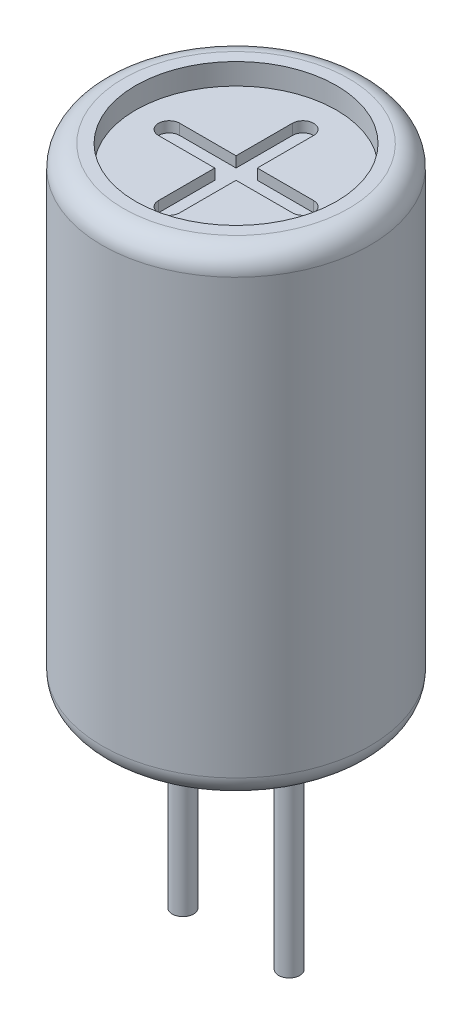
from build123d import *

# Parameters (mm, degrees)
SKETCH_2_R          = 3.15
EXTRUDE_1_DEPTH     = 11.2
FILLET_1_R          = 0.5
SKETCH_3_R          = 0.25
EXTRUDE_2_DEPTH     = 5
SKETCH_5_R          = 2.3625
CUT_EXTRUDE_1_DEPTH = 1
EXTRUDE_START       = 0.5
SKETCH_6_R          = 2.3625
EXTRUDE_3_DEPTH     = 0.5
CUT_EXTRUDE_2_DEPTH = 0.25
CUT_EXTRUDE_3_DEPTH = 0.25


with BuildPart() as part:
    # 草图2 → 凸台-拉伸1 (new body)
    with BuildSketch(Plane(origin=(0, 0, 0), x_dir=(1, 0, 0), z_dir=(0, 1, 0))):
        with Locations(Location((0, 0, 0), (0, 0, 270))):
            Circle(SKETCH_2_R)
    extrude(amount=EXTRUDE_1_DEPTH)

    # 圆角1
    fillet_1_edges = [part.edges().sort_by_distance(p)[0] for p in [
        (0, 0, -3.15),
        (0, 11.2, -3.15),
    ]]
    fillet(fillet_1_edges, radius=FILLET_1_R)

    # 草图3 → 凸台-拉伸2 (add)
    with BuildSketch(Plane.XZ):
        with Locations(Location((-1.25, 0, 0), (0, 0, 90))):
            Circle(SKETCH_3_R)
        with Locations(Location((1.25, 0, 0), (0, 0, 90))):
            Circle(SKETCH_3_R)
    extrude(amount=EXTRUDE_2_DEPTH)

    # 草图5 → 切除-拉伸1 (cut)
    with BuildSketch(Plane(origin=(0, 11.2, 0), x_dir=(1, 0, 0), z_dir=(0, 1, 0))):
        with Locations(Location((0, 0, 0), (0, 0, 270))):
            Circle(SKETCH_5_R)
    extrude(amount=-CUT_EXTRUDE_1_DEPTH, mode=Mode.SUBTRACT)

    # 草图6 → 凸台-拉伸3 (add)
    with BuildSketch(Plane(origin=(0, 10.2, 0), x_dir=(1, 0, 0), z_dir=(0, 1, 0)).offset(EXTRUDE_START)):
        with Locations(Location((0, 0, 0), (0, 0, 270))):
            Circle(SKETCH_6_R)
    extrude(amount=-EXTRUDE_3_DEPTH)

    # 草图7 → 切除-拉伸2 (cut)
    with BuildSketch(Plane(origin=(0, 10.7, 0), x_dir=(1, 0, 0), z_dir=(0, 1, 0))):
        with BuildLine():
            Line((-1.575, 0.25), (1.575, 0.25))
            ThreePointArc((1.575, 0.25), (1.825, 0), (1.575, -0.25))
            Line((1.575, -0.25), (-1.575, -0.25))
            ThreePointArc((-1.575, -0.25), (-1.825, 0), (-1.575, 0.25))
        make_face()
    extrude(amount=-CUT_EXTRUDE_2_DEPTH, mode=Mode.SUBTRACT)

    # 草图8 → 切除-拉伸3 (cut)
    with BuildSketch(Plane(origin=(0, 10.7, 0), x_dir=(1, 0, 0), z_dir=(0, 1, 0))):
        with BuildLine():
            Line((-0.25, -1.575), (-0.25, 1.575))
            ThreePointArc((-0.25, 1.575), (0, 1.825), (0.25, 1.575))
            Line((0.25, 1.575), (0.25, -1.575))
            ThreePointArc((0.25, -1.575), (0, -1.825), (-0.25, -1.575))
        make_face()
    extrude(amount=-CUT_EXTRUDE_3_DEPTH, mode=Mode.SUBTRACT)


solid = part.part
